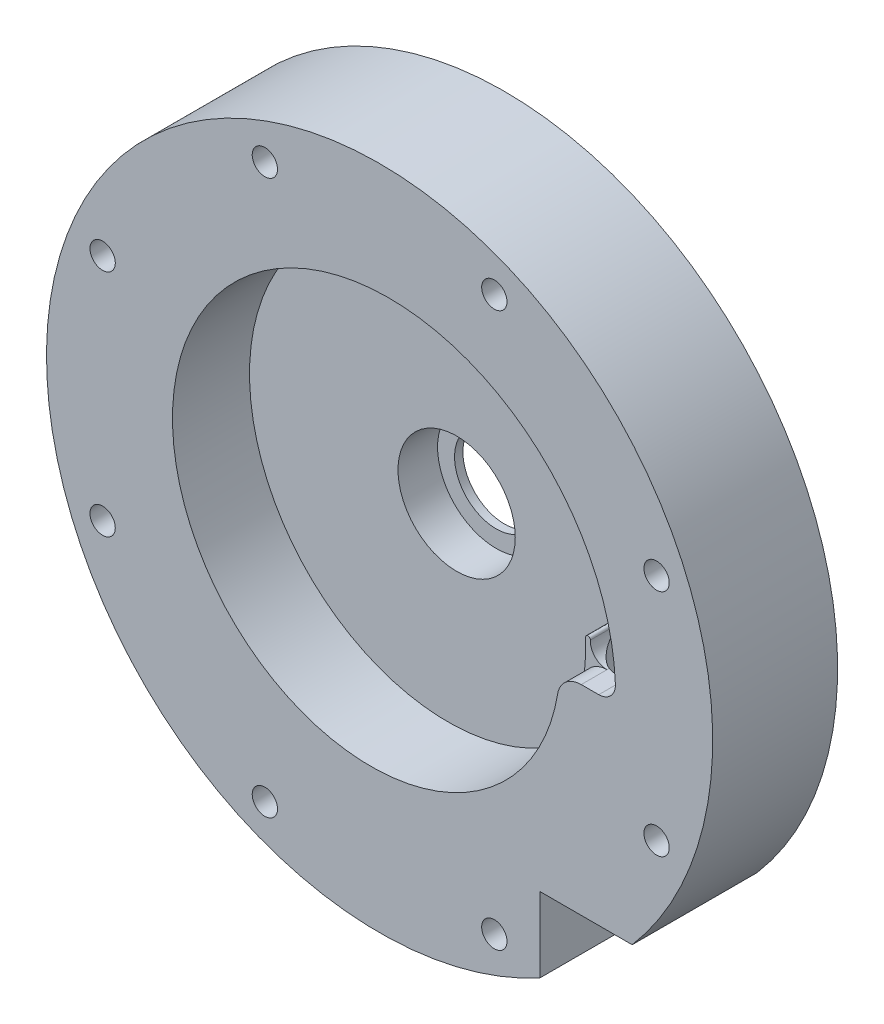
from build123d import *

# Parameters (mm, degrees)
CUT_EXTRUDE1_DEPTH                = 91.99522443
CUT_EXTRUDE2_DEPTH                = 92.771343028
SKETCH7_W                         = 17.562845607
SKETCH7_H                         = 23.8125
OUTLET_CUT_DEPTH                  = 124.503052336
PIPE_TAP_DRILL_FOR_3_8_TAP1_D     = 14.2748
PIPE_TAP_DRILL_FOR_3_8_TAP1_DEPTH = 12.7
PIPE_TAP_DRILL_FOR_3_8_TAP1_TIP   = 4.288582582
SKETCH26_R                        = 2.413
CUT_EXTRUDE3_DEPTH                = 93.906055678
CIRPATTERN1_COUNT                 = 8


with BuildPart() as part:
    # Sketch22 → Revolve1 (revolve)
    with BuildSketch(Plane(origin=(0, 0, 0), x_dir=(1, 0, 0), z_dir=(0, 1, 0)), mode=Mode.PRIVATE) as revolve1_sk:
        Polygon((-25.4, 0), (-11.176, 0), (-11.176, 7.540625), (-7.9375, 7.540625), (-7.9375, 9.128125), (-63.5, 9.128125), (-63.5, -14.684375), (-25.4, -14.684375), align=None)
    revolve(revolve1_sk.sketch.rotate(Axis((0, 0, 0), (0, 0, -1)), 180), axis=Axis((0, 0, 0), (0, 0, -1)))

    # Sketch23 → Cut-Extrude1 (cut, through all)
    with BuildSketch(Plane.XY):
        with BuildLine():
            Line((38.437947958, -3.305305064), (41.774484968, -3.305305064))
            ThreePointArc((41.774484968, -3.305305064), (44.065155566, -2.328816654), (44.946809919, 0))
            add(Edge.make_bspline(
                [(34.358843007, 0), (34.361802439, -0.072048451), (34.36772212, -0.216165285), (34.374921255, -0.432434253), (34.380873566, -0.648799768), (34.390042435, -1.081895785), (34.395730042, -2.094127987), (34.342399588, -3.613937083), (34.182429281, -5.420127827), (33.941499772, -7.148241139), (33.613407498, -8.8658869), (33.198558281, -10.568668335), (32.697590483, -12.252202478), (32.111368753, -13.912132646), (31.440982434, -15.544140087), (30.6877424, -17.143955629), (29.853178348, -18.707371069), (28.939035433, -20.230250424), (27.947270591, -21.708540989), (26.880048317, -23.138284208), (25.739735978, -24.515626324), (24.52889861, -25.836828804), (23.250293206, -27.098278486), (21.906862513, -28.296497465), (20.501728328, -29.428152646), (19.038184319, -30.490064988), (17.519688378, -31.479218369), (15.949854523, -32.392768086), (14.332444364, -33.228048947), (12.67135816, -33.982582934), (10.970625473, -34.654086422), (9.23439546, -35.240476937), (7.466926803, -35.739879413), (5.672577322, -36.150631964), (3.855793286, -36.471291116), (2.021098439, -36.700636517), (0.173082793, -36.837675086), (-1.683608814, -36.881644605), (-3.544288344, -36.832016725), (-5.404236353, -36.688499397), (-7.258713917, -36.451038699), (-9.102974666, -36.119820063), (-10.932276886, -35.695268896), (-12.741895669, -35.178050585), (-14.527135072, -34.569069886), (-16.283340262, -33.869469699), (-18.005909603, -33.080629222), (-19.690306669, -32.204161496), (-21.332072136, -31.241910334), (-22.926835541, -30.195946649), (-24.470326852, -29.068564177), (-25.958387849, -27.862274615), (-27.386983251, -26.579802172), (-28.752211598, -25.224077558), (-30.05031582, -23.798231409), (-31.277693495, -22.305587173), (-32.430906752, -20.749653473), (-33.506691795, -19.134115953), (-34.501968029, -17.462828639), (-35.41384675, -15.739804832), (-36.239639383, -13.969207544), (-36.976865247, -12.155339516), (-37.623258819, -10.302632827), (-38.176776478, -8.415638129), (-38.635602708, -6.499013531), (-38.99815575, -4.557513153), (-39.263092672, -2.595975388), (-39.429313851, -0.619310898), (-39.495966855, 1.367509636), (-39.462449705, 3.359467962), (-39.328413504, 5.351510889), (-39.09376444, 7.338563062), (-38.758665131, 9.315539846), (-38.323535331, 11.277360294), (-37.789051968, 13.218960162), (-37.15614853, 15.135304935), (-36.426013787, 17.021402835), (-35.600089858, 18.872317778), (-34.680069611, 20.683182241), (-33.667893419, 22.449210007), (-32.565745258, 24.165708766), (-31.376048171, 25.828092515), (-30.101459097, 27.431893755), (-28.744863072, 28.972775422), (-27.309366835, 30.446542545), (-25.798291819, 31.849153584), (-24.215166578, 33.176731426), (-22.563718643, 34.425574005), (-20.847865831, 35.59216452), (-19.071707037, 36.673181218), (-17.239512511, 37.665506723), (-15.355713667, 38.566236878), (-13.424892429, 39.37268908), (-11.451770141, 40.082410076), (-9.441196087, 40.693183217), (-7.398135616, 41.203035118), (-5.327657937, 41.610241741), (-3.234923583, 41.913333848), (-1.125171597, 42.11110184), (0.996293545, 42.202599933), (3.124115223, 42.187149688), (5.252898166, 42.06434287), (7.377222085, 41.834043617), (9.491655438, 41.49638993), (11.590769276, 41.051794458), (13.669151145, 40.500944594), (15.721418994, 39.844801852), (17.742235078, 39.084600556), (19.726319787, 38.221845804), (21.668465399, 37.258310751), (23.563549696, 36.196033176), (25.406549423, 35.037311368), (27.192553543, 33.784699317), (28.916776264, 32.441001244), (30.574569796, 31.009265451), (32.161436808, 29.492777532), (33.673042551, 27.895052942), (35.10522661, 26.219828948), (36.454014261, 24.471055979), (37.715627401, 22.652888394), (38.88649501, 20.769674689), (39.963263134, 18.825947167), (40.942804349, 16.826411093), (41.822226678, 14.775933368), (42.59888195, 12.679530733), (43.27037356, 10.54235755), (43.834563622, 8.369693173), (44.289579482, 6.166928958), (44.619434592, 4.032631678), (44.788721316, 2.443473873), (44.861866668, 1.505376084), (44.887603288, 1.129504244), (44.905146434, 0.847378207), (44.920882878, 0.565074904), (44.934972992, 0.282611952), (44.942863945, 0.09421189), (44.946809919, 0)],
                knots=[0, 0, 0, 0, 0.000870606, 0.001741453, 0.002612539, 0.003483865, 0.006971562, 0.014832926, 0.021837209, 0.028857006, 0.035892384, 0.042943403, 0.050010121, 0.057092589, 0.064190856, 0.07130497, 0.078434976, 0.085580915, 0.092742831, 0.099920762, 0.107114747, 0.114324823, 0.121551027, 0.128793394, 0.136051958, 0.143326753, 0.150617811, 0.157925165, 0.165248846, 0.172588885, 0.179945312, 0.187318157, 0.194707448, 0.202113215, 0.209535486, 0.216974287, 0.224429648, 0.231901594, 0.239390153, 0.246895349, 0.25441721, 0.261955761, 0.269511026, 0.277083032, 0.284671801, 0.29227736, 0.299899731, 0.307538938, 0.315195006, 0.322867957, 0.330557814, 0.338264601, 0.345988339, 0.353729051, 0.36148676, 0.369261487, 0.377053255, 0.384862084, 0.392687996, 0.400531013, 0.408391155, 0.416268443, 0.424162899, 0.432074542, 0.440003393, 0.447949473, 0.455912802, 0.463893399, 0.471891284, 0.479906477, 0.487938998, 0.495988866, 0.5040561, 0.51214072, 0.520242745, 0.528362193, 0.536499083, 0.544653435, 0.552825266, 0.561014596, 0.569221442, 0.577445824, 0.585687758, 0.593947263, 0.602224358, 0.61051906, 0.618831386, 0.627161355, 0.635508984, 0.643874291, 0.652257292, 0.660658007, 0.66907645, 0.677512641, 0.685966595, 0.69443833, 0.702927863, 0.711435211, 0.71996039, 0.728503417, 0.737064309, 0.745643082, 0.754239753, 0.762854337, 0.771486853, 0.780137315, 0.788805739, 0.797492143, 0.806196542, 0.814918952, 0.823659389, 0.832417868, 0.841194407, 0.849989019, 0.858801722, 0.86763253, 0.87648146, 0.885348526, 0.894233744, 0.90313713, 0.912058699, 0.920998466, 0.929956446, 0.938932655, 0.947927107, 0.956939818, 0.965970803, 0.975020076, 0.984087653, 0.992036809, 0.994310574, 0.995447886, 0.996585485, 0.99772337, 0.998861542, 1, 1, 1, 1], degree=3))
            ThreePointArc((34.358843007, 0), (34.812233007, 0.472395573), (35.265623007, 0))
            ThreePointArc((35.265623007, 0), (36.14727736, -2.328816654), (38.437947958, -3.305305064))
        make_face()
    extrude(amount=CUT_EXTRUDE1_DEPTH, mode=Mode.SUBTRACT)

    # Sketch25 → Cut-Extrude2 (cut, through all)
    with BuildSketch(Plane.XY.offset(9.779)):
        with BuildLine():
            ThreePointArc((41.774484968, -3.305305064), (44.065155566, -2.328816654), (44.946809919, 0))
            add(Edge.make_bspline(
                [(44.946809919, 0), (44.942863945, 0.09421189), (44.934972992, 0.282611952), (44.920882878, 0.565074904), (44.905146434, 0.847378207), (44.887603288, 1.129504244), (44.861866668, 1.505376084), (44.788721316, 2.443473873), (44.619434592, 4.032631678), (44.289579482, 6.166928958), (43.834563622, 8.369693173), (43.27037356, 10.54235755), (42.59888195, 12.679530733), (41.822226678, 14.775933368), (40.942804349, 16.826411093), (39.963263134, 18.825947167), (38.88649501, 20.769674689), (37.715627401, 22.652888394), (36.454014261, 24.471055979), (35.10522661, 26.219828948), (33.673042551, 27.895052942), (32.161436808, 29.492777532), (30.574569796, 31.009265451), (28.916776264, 32.441001244), (27.192553543, 33.784699317), (25.406549423, 35.037311368), (23.563549696, 36.196033176), (21.668465399, 37.258310751), (19.726319787, 38.221845804), (17.742235078, 39.084600556), (15.721418994, 39.844801852), (13.669151145, 40.500944594), (11.590769276, 41.051794458), (9.491655438, 41.49638993), (7.377222085, 41.834043617), (5.252898166, 42.06434287), (3.124115223, 42.187149688), (0.996293545, 42.202599933), (-1.125171597, 42.11110184), (-3.234923583, 41.913333848), (-5.327657937, 41.610241741), (-7.398135616, 41.203035118), (-9.441196087, 40.693183217), (-11.451770141, 40.082410076), (-13.424892429, 39.37268908), (-15.355713667, 38.566236878), (-17.239512511, 37.665506723), (-19.071707037, 36.673181218), (-20.847865831, 35.59216452), (-22.563718643, 34.425574005), (-24.215166578, 33.176731426), (-25.798291819, 31.849153584), (-27.309366835, 30.446542545), (-28.744863072, 28.972775422), (-30.101459097, 27.431893755), (-31.376048171, 25.828092515), (-32.565745258, 24.165708766), (-33.667893419, 22.449210007), (-34.680069611, 20.683182241), (-35.600089858, 18.872317778), (-36.426013787, 17.021402835), (-37.15614853, 15.135304935), (-37.789051968, 13.218960162), (-38.323535331, 11.277360294), (-38.758665131, 9.315539846), (-39.09376444, 7.338563062), (-39.328413504, 5.351510889), (-39.462449705, 3.359467962), (-39.495966855, 1.367509636), (-39.429313851, -0.619310898), (-39.263092672, -2.595975388), (-38.99815575, -4.557513153), (-38.635602708, -6.499013531), (-38.176776478, -8.415638129), (-37.623258819, -10.302632827), (-36.976865247, -12.155339516), (-36.239639383, -13.969207544), (-35.41384675, -15.739804832), (-34.501968029, -17.462828639), (-33.506691795, -19.134115953), (-32.430906752, -20.749653473), (-31.277693495, -22.305587173), (-30.05031582, -23.798231409), (-28.752211598, -25.224077558), (-27.386983251, -26.579802172), (-25.958387849, -27.862274615), (-24.470326852, -29.068564177), (-22.926835541, -30.195946649), (-21.332072136, -31.241910334), (-19.690306669, -32.204161496), (-18.005909603, -33.080629222), (-16.283340262, -33.869469699), (-14.527135072, -34.569069886), (-12.741895669, -35.178050585), (-10.932276886, -35.695268896), (-9.102974666, -36.119820063), (-7.258713917, -36.451038699), (-5.404236353, -36.688499397), (-3.544288344, -36.832016725), (-1.683608814, -36.881644605), (0.173082793, -36.837675086), (2.021098439, -36.700636517), (3.855793286, -36.471291116), (5.672577322, -36.150631964), (7.466926803, -35.739879413), (9.23439546, -35.240476937), (10.970625473, -34.654086422), (12.67135816, -33.982582934), (14.332444364, -33.228048947), (15.949854523, -32.392768086), (17.519688378, -31.479218369), (19.038184319, -30.490064988), (20.501728328, -29.428152646), (21.906862513, -28.296497465), (23.250293206, -27.098278486), (24.52889861, -25.836828804), (25.739735978, -24.515626324), (26.880048317, -23.138284208), (27.947270591, -21.708540989), (28.939035433, -20.230250424), (29.853178348, -18.707371069), (30.6877424, -17.143955629), (31.440982434, -15.544140087), (32.111368753, -13.912132646), (32.697590483, -12.252202478), (33.198558281, -10.568668335), (33.613407498, -8.8658869), (33.941499772, -7.148241139), (34.182429281, -5.420127827), (34.342399588, -3.613937083), (34.395730042, -2.094127987), (34.390042435, -1.081895785), (34.380873566, -0.648799768), (34.374921255, -0.432434253), (34.36772212, -0.216165285), (34.361802439, -0.072048451), (34.358843007, 0)],
                knots=[0, 0, 0, 0, 0.001138458, 0.00227663, 0.003414515, 0.004552114, 0.005689426, 0.007963191, 0.015912347, 0.024979924, 0.034029197, 0.043060182, 0.052072893, 0.061067345, 0.070043554, 0.079001534, 0.087941301, 0.09686287, 0.105766256, 0.114651474, 0.12351854, 0.13236747, 0.141198278, 0.150010981, 0.158805593, 0.167582132, 0.176340611, 0.185081048, 0.193803458, 0.202507857, 0.211194261, 0.219862685, 0.228513147, 0.237145663, 0.245760247, 0.254356918, 0.262935691, 0.271496583, 0.28003961, 0.288564789, 0.297072137, 0.30556167, 0.314033405, 0.322487359, 0.33092355, 0.339341993, 0.347742708, 0.356125709, 0.364491016, 0.372838645, 0.381168614, 0.38948094, 0.397775642, 0.406052737, 0.414312242, 0.422554176, 0.430778558, 0.438985404, 0.447174734, 0.455346565, 0.463500917, 0.471637807, 0.479757255, 0.48785928, 0.4959439, 0.504011134, 0.512061002, 0.520093523, 0.528108716, 0.536106601, 0.544087198, 0.552050527, 0.559996607, 0.567925458, 0.575837101, 0.583731557, 0.591608845, 0.599468987, 0.607312004, 0.615137916, 0.622946745, 0.630738513, 0.63851324, 0.646270949, 0.654011661, 0.661735399, 0.669442186, 0.677132043, 0.684804994, 0.692461062, 0.700100269, 0.70772264, 0.715328199, 0.722916968, 0.730488974, 0.738044239, 0.74558279, 0.753104651, 0.760609847, 0.768098406, 0.775570352, 0.783025713, 0.790464514, 0.797886785, 0.805292552, 0.812681843, 0.820054688, 0.827411115, 0.834751154, 0.842074835, 0.849382189, 0.856673247, 0.863948042, 0.871206606, 0.878448973, 0.885675177, 0.892885253, 0.900079238, 0.907257169, 0.914419085, 0.921565024, 0.92869503, 0.935809144, 0.942907411, 0.949989879, 0.957056597, 0.964107616, 0.971142994, 0.978162791, 0.985167074, 0.993028438, 0.996516135, 0.997387461, 0.998258547, 0.999129394, 1, 1, 1, 1], degree=3))
            ThreePointArc((34.358843007, 0), (34.812233007, 0.472395573), (35.265623007, 0))
            ThreePointArc((35.265623007, 0), (36.14727736, -2.328816654), (38.437947958, -3.305305064))
            Line((38.437947958, -3.305305064), (41.774484968, -3.305305064))
        make_face()
        with BuildLine():
            ThreePointArc((33.92935392, -7.132057792), (35.481114489, -4.390968776), (38.437947958, -3.305305064))
            ThreePointArc((38.437947958, -3.305305064), (36.14727736, -2.328816654), (35.265623007, 0))
            ThreePointArc((35.265623007, 0), (34.812233007, 0.472395573), (34.358843007, 0))
            add(Edge.make_bspline(
                [(33.92935392, -7.132057792), (34.023156129, -6.562539584), (34.182802817, -5.415910306), (34.342399588, -3.613937083), (34.395730042, -2.094127987), (34.390042435, -1.081895785), (34.380873566, -0.648799768), (34.374921255, -0.432434253), (34.36772212, -0.216165285), (34.361802439, -0.072048451), (34.358843007, 0)],
                knots=[0.971194098, 0.971194098, 0.971194098, 0.971194098, 0.978162791, 0.985167074, 0.993028438, 0.996516135, 0.997387461, 0.998258547, 0.999129394, 1, 1, 1, 1], degree=3))
        make_face()
    extrude(amount=CUT_EXTRUDE2_DEPTH, mode=Mode.SUBTRACT)

    # Sketch7 → Outlet Cut (cut, through all)
    with BuildSketch(Plane(origin=(0, -41.405305064, 0), x_dir=(1, 0, 0), z_dir=(0, 1, 0))):
        with Locations((39.362639267, -2.778125)):
            Rectangle(SKETCH7_W, SKETCH7_H)
    extrude(amount=-OUTLET_CUT_DEPTH, mode=Mode.SUBTRACT)

    # Sketch20 → 3/8 (0.375) Diameter Hole1 (revolve, cut)
    with BuildSketch(Plane(origin=(40.106216463, -41.405305064, 4.8895), x_dir=(0, 0, -1), z_dir=(1, 0, 0))):
        Polygon((0, 0), (0, 43.501598698), (4.7625, 40.64), (4.7625, 0), align=None)
    revolve(axis=Axis((40.106216463, -47.755305064, 4.8895), (0, 1, 0)), mode=Mode.SUBTRACT)

    # Pipe Tap Drill for 3/8 Tap1
    with Locations(Plane(origin=(40.106216463, -41.405305064, 4.8895), x_dir=(0, 0, -1), z_dir=(0, -1, 0))):
        with Locations((0, 0)):
            Hole(PIPE_TAP_DRILL_FOR_3_8_TAP1_D / 2, depth=PIPE_TAP_DRILL_FOR_3_8_TAP1_DEPTH)
            with Locations((0, 0, -(PIPE_TAP_DRILL_FOR_3_8_TAP1_DEPTH + PIPE_TAP_DRILL_FOR_3_8_TAP1_TIP / 2))):  # 118° drill point
                Cone(0, PIPE_TAP_DRILL_FOR_3_8_TAP1_D / 2, PIPE_TAP_DRILL_FOR_3_8_TAP1_TIP, mode=Mode.SUBTRACT)

    # Sketch26 → Cut-Extrude3 (cut, through all)
    with BuildSketch(Plane.XY.offset(14.684375)):
        with Locations((52.799715283, -21.87035816)):
            Circle(SKETCH26_R)
    cut_extrude3 = extrude(amount=-CUT_EXTRUDE3_DEPTH, mode=Mode.SUBTRACT)

    # CirPattern1: Cut-Extrude3 ×8 about axis
    cirpattern1_axis = Axis((0, 0, 0), (0, 0, 1))
    for i in range(1, CIRPATTERN1_COUNT):
        add(cut_extrude3.rotate(cirpattern1_axis, i * 360 / CIRPATTERN1_COUNT), mode=Mode.SUBTRACT)


solid = part.part
